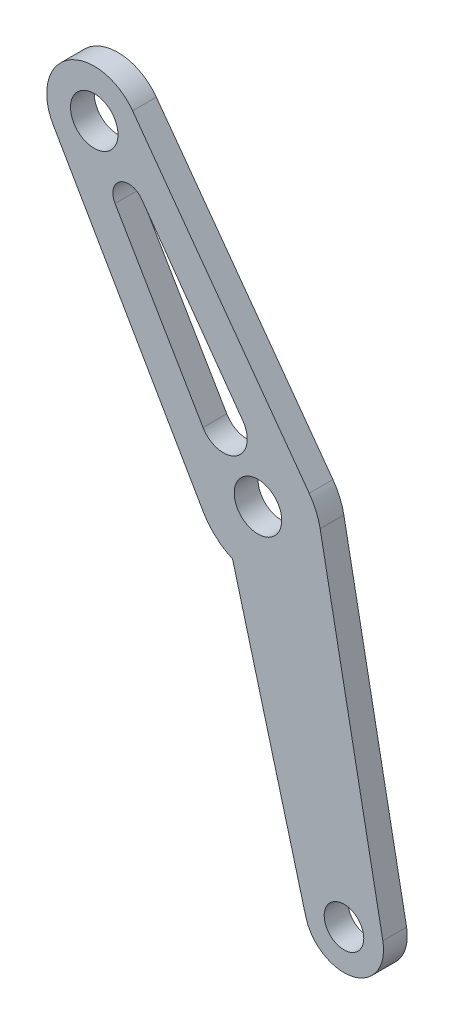
from build123d import *

# Parameters (mm, degrees)
SKETCH_1_R      = 2.5
SKETCH_1_R_2    = 3
EXTRUDE_1_DEPTH = 3


with BuildPart() as part:
    # 草图1 → 凸台-拉伸1 (new body)
    with BuildSketch(Plane.XY):
        with BuildLine():
            ThreePointArc((-26.713625486, 75.966514608), (-34.834517435, 77.470389694), (-36.763723512, 69.439904638))
            Line((-36.763723512, 69.439904638), (-17.799786944, 36.57093584))
            ThreePointArc((-17.799786944, 36.57093584), (-16.207817762, 34.609692603), (-14.083704607, 33.242584627))
            Line((-14.083704607, 33.242584627), (-4.829629131, -1.294095226))
            ThreePointArc((-4.829629131, -1.294095226), (1.120671585, -4.872791315), (4.909728267, 0.945816231))
            Line((4.909728267, 0.945816231), (-3.014834667, 42.082190674))
            ThreePointArc((-3.014834667, 42.082190674), (-3.531719554, 43.753813411), (-4.399656243, 45.273082467))
            Line((-4.399656243, 45.273082467), (-26.713625486, 75.966514608))
        make_face()
        Circle(SKETCH_1_R, mode=Mode.SUBTRACT)
        with BuildLine():
            Line((-17.815192308, 45.760385115), (-28.934691034, 64.71709232))
            ThreePointArc((-28.934691034, 64.71709232), (-28.298849015, 67.406342878), (-25.583476135, 66.893396722))
            Line((-25.583476135, 66.893396722), (-12.788369959, 49.024841717))
            ThreePointArc((-12.788369959, 49.024841717), (-13.593595069, 44.762237544), (-17.815192308, 45.760385115))
        make_face(mode=Mode.SUBTRACT)
        with Locations((-31.566683225, 72.438366286)):
            Circle(SKETCH_1_R_2, mode=Mode.SUBTRACT)
        with Locations((-10.870399894, 40.568884704)):
            Circle(SKETCH_1_R_2, mode=Mode.SUBTRACT)
    extrude(amount=EXTRUDE_1_DEPTH)


solid = part.part
